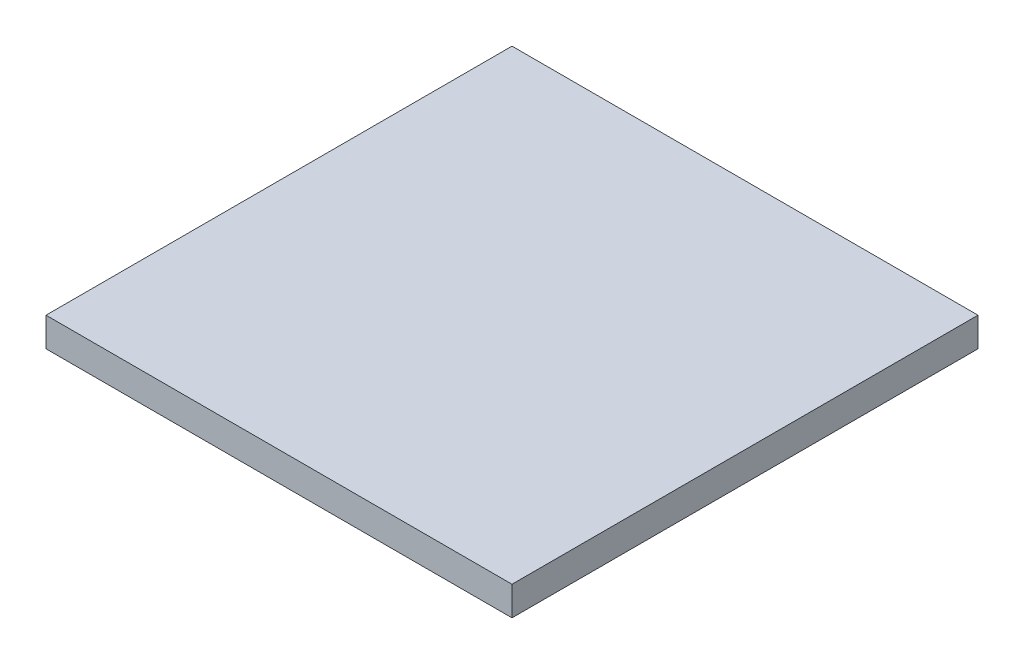
from build123d import *

# Parameters (mm, degrees)
SKETCH1_W           = 25.4
SKETCH1_H           = 25.4
BOSS_EXTRUDE1_DEPTH = 1.5875
BOSS_EXTRUDE2_DEPTH = 3.302


with BuildPart() as part:
    # Sketch1 → Boss-Extrude1 (new body)
    with BuildSketch(Plane(origin=(0, 0, 0), x_dir=(1, 0, 0), z_dir=(0, 1, 0))):
        with Locations((-11.947275054, 12.711155892)):
            Rectangle(SKETCH1_W, SKETCH1_H)
    extrude(amount=BOSS_EXTRUDE1_DEPTH)

    # Sketch2 → Boss-Extrude2 (add)
    with BuildSketch(Plane(origin=(0, 0, 0), x_dir=(-1, 0, 0), z_dir=(0, -1, 0))):
        Polygon((17.95497638, 12.711155892), (5.939573728, 12.711155892), (4.886075054, 15.759155892), (4.886075054, 25.411155892), (19.008475054, 25.411155892), (19.008475054, 15.759155892), align=None)
    extrude(amount=BOSS_EXTRUDE2_DEPTH)


solid = part.part
